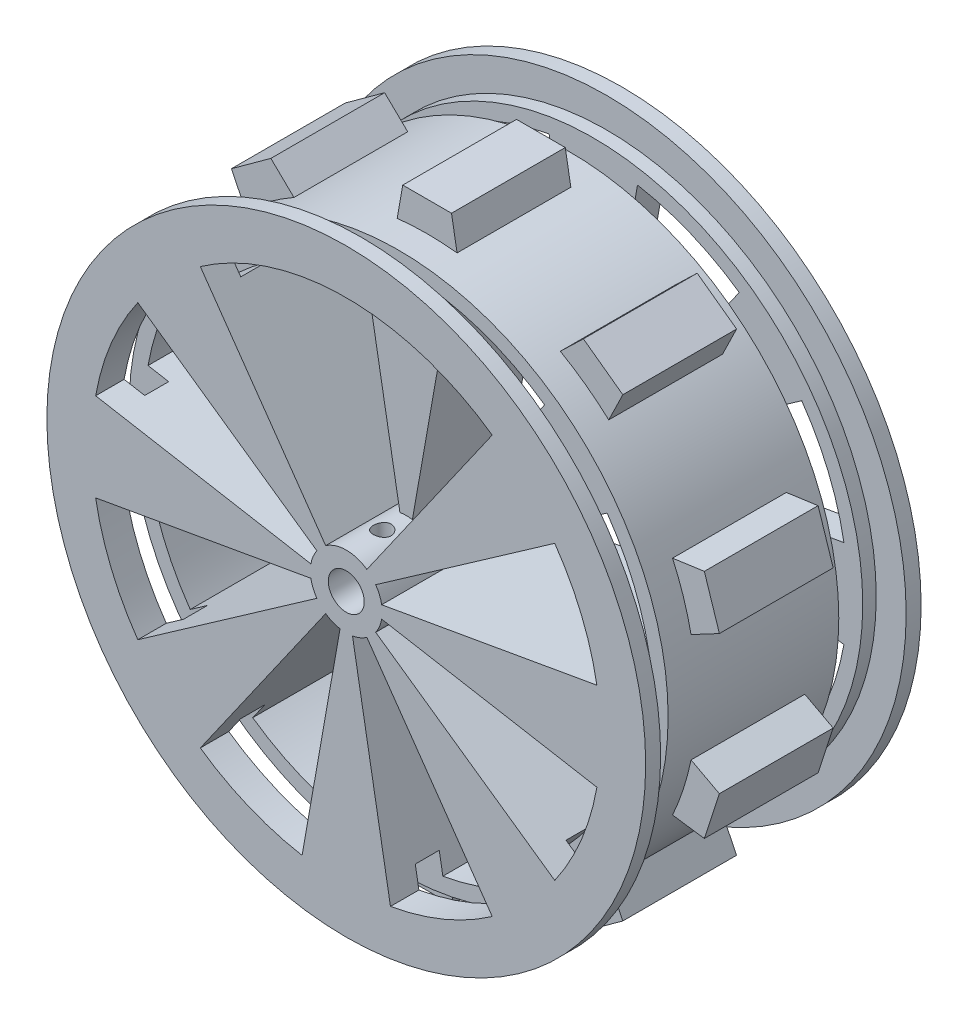
from build123d import *
from build123d.topology import SkipClean

# Parameters (mm, degrees)
CROQUIS2_R                   = 45
CROQUIS2_R_2                 = 7.5
SALIENTE_EXTRUIR1_DEPTH      = 40
SALIENTE_EXTRUIR2_DEPTH      = 9.5
SALIENTE_EXTRUIR2_DEPTH_BACK = 9.5
CROQUIS4_R                   = 42.5
CORTAR_EXTRUIR1_DEPTH        = 58
SALIENTE_EXTRUIR3_START      = 3
CROQUIS5_R                   = 50
CROQUIS5_R_2                 = 42.5
SALIENTE_EXTRUIR3_DEPTH      = 3
CROQUIS6_R                   = 50
CROQUIS6_R_2                 = 45
CORTAR_EXTRUIR2_DEPTH        = 0.5
CROQUIS7_R                   = 50
CROQUIS7_R_2                 = 42.5
SALIENTE_EXTRUIR4_DEPTH      = 3
CROQUIS8_R                   = 50
CROQUIS8_R_2                 = 45
CORTAR_EXTRUIR3_DEPTH        = 0.5
CROQUIS9_R                   = 3
SALIENTE_EXTRUIR5_DEPTH      = 46
CORTAR_EXTRUIR5_DEPTH        = 10
CROQUIS13_R                  = 1.5
CORTAR_EXTRUIR7_DEPTH        = 7
CROQUIS15_W                  = 6
CROQUIS15_H                  = 4
CROQUIS16_R                  = 30
CORTAR_EXTRUIR8_DEPTH        = 20


with BuildPart() as part:
    # Croquis2 → Saliente-Extruir1 (new body)
    with BuildSketch(Plane.XY):
        Circle(CROQUIS2_R)
        Circle(CROQUIS2_R_2, mode=Mode.SUBTRACT)
    extrude(amount=SALIENTE_EXTRUIR1_DEPTH)

    # Croquis3 → Saliente-Extruir2 (add, two sides: drawn at the far end of the back side and taken through both)
    with BuildSketch(Plane.XY.offset(20).offset(-SALIENTE_EXTRUIR2_DEPTH_BACK)):
        with BuildLine():
            ThreePointArc((-4.995681638, 44.721842146), (0.004345244, 44.99999979), (5.004318315, 44.720876537))
            Line((5.004318315, 44.720876537), (4.073466414, 50))
            Line((4.073466414, 50), (0, 50))
            Line((0, 50), (-4.065, 50))
            Line((-4.065, 50), (-4.995681638, 44.721842146))
        make_face()
        with BuildLine():
            Line((29.389262615, 40.450849719), (26.100608532, 42.840196769))
            Line((26.100608532, 42.840196769), (22.245247925, 39.117118308))
            ThreePointArc((22.245247925, 39.117118308), (26.453851606, 36.403210507), (30.33485026, 33.238484618))
            Line((30.33485026, 33.238484618), (32.68476617, 38.056526235))
            Line((32.68476617, 38.056526235), (29.389262615, 40.450849719))
        make_face()
        with BuildLine():
            Line((46.296671733, 19.316894457), (40.989248869, 18.570984818))
            ThreePointArc((40.989248869, 18.570984818), (42.798885788, 13.901632109), (44.078500449, 9.06012131))
            Line((44.078500449, 9.06012131), (48.811596163, 11.576752942))
            Line((48.811596163, 11.576752942), (47.552825815, 15.450849719))
            Line((47.552825815, 15.450849719), (46.296671733, 19.316894457))
        make_face()
        with BuildLine():
            Line((48.808979897, -11.58480498), (44.076749919, -9.068633668))
            ThreePointArc((44.076749919, -9.068633668), (42.796200279, -13.909897255), (40.98566164, -18.578900397))
            Line((40.98566164, -18.578900397), (46.294055467, -19.324946496))
            Line((46.294055467, -19.324946496), (47.552825815, -15.450849719))
            Line((47.552825815, -15.450849719), (48.808979897, -11.58480498))
        make_face()
        with BuildLine():
            Line((32.677916697, -38.061502668), (30.328430613, -33.244342324))
            ThreePointArc((30.328430613, -33.244342324), (26.446820853, -36.408318648), (22.237693135, -39.121413625))
            Line((22.237693135, -39.121413625), (26.093759059, -42.845173203))
            Line((26.093759059, -42.845173203), (29.389262615, -40.450849719))
            Line((29.389262615, -40.450849719), (32.677916697, -38.061502668))
        make_face()
        with BuildLine():
            Line((4.065, -50), (4.995681638, -44.721842146))
            ThreePointArc((4.995681638, -44.721842146), (-0.004345244, -44.99999979), (-5.004318315, -44.720876537))
            Line((-5.004318315, -44.720876537), (-4.073466414, -50))
            Line((-4.073466414, -50), (0, -50))
            Line((0, -50), (4.065, -50))
        make_face()
        with BuildLine():
            ThreePointArc((-22.245247925, -39.117118308), (-26.453851606, -36.403210507), (-30.33485026, -33.238484618))
            Line((-30.33485026, -33.238484618), (-32.68476617, -38.056526235))
            Line((-32.68476617, -38.056526235), (-29.389262615, -40.450849719))
            Line((-29.389262615, -40.450849719), (-26.100608532, -42.840196769))
            Line((-26.100608532, -42.840196769), (-22.245247925, -39.117118308))
        make_face()
        with BuildLine():
            ThreePointArc((-40.989248869, -18.570984818), (-42.798885788, -13.901632109), (-44.078500449, -9.06012131))
            Line((-44.078500449, -9.06012131), (-48.811596163, -11.576752942))
            Line((-48.811596163, -11.576752942), (-47.552825815, -15.450849719))
            Line((-47.552825815, -15.450849719), (-46.296671733, -19.316894457))
            Line((-46.296671733, -19.316894457), (-40.989248869, -18.570984818))
        make_face()
        with BuildLine():
            ThreePointArc((-30.328430613, 33.244342324), (-26.446820853, 36.408318648), (-22.237693135, 39.121413625))
            Line((-22.237693135, 39.121413625), (-26.093759059, 42.845173203))
            Line((-26.093759059, 42.845173203), (-29.389262615, 40.450849719))
            Line((-29.389262615, 40.450849719), (-32.677916697, 38.061502668))
            Line((-32.677916697, 38.061502668), (-30.328430613, 33.244342324))
        make_face()
        with BuildLine():
            ThreePointArc((-44.076749919, 9.068633668), (-42.796200279, 13.909897255), (-40.98566164, 18.578900397))
            Line((-40.98566164, 18.578900397), (-46.294055467, 19.324946496))
            Line((-46.294055467, 19.324946496), (-47.552825815, 15.450849719))
            Line((-47.552825815, 15.450849719), (-48.808979897, 11.58480498))
            Line((-48.808979897, 11.58480498), (-44.076749919, 9.068633668))
        make_face()
    extrude(amount=SALIENTE_EXTRUIR2_DEPTH + SALIENTE_EXTRUIR2_DEPTH_BACK)

    # Croquis4 → Cortar-Extruir1 (cut)
    with BuildSketch(Plane.XY.offset(40)):
        Circle(CROQUIS4_R)
    extrude(amount=-CORTAR_EXTRUIR1_DEPTH, mode=Mode.SUBTRACT)

    # Croquis5 → Saliente-Extruir3 (add)
    with BuildSketch(Plane.XY.offset(40).offset(SALIENTE_EXTRUIR3_START)):
        Circle(CROQUIS5_R)
        Circle(CROQUIS5_R_2, mode=Mode.SUBTRACT)
    extrude(amount=-SALIENTE_EXTRUIR3_DEPTH)

    # Croquis6 → Cortar-Extruir2 (cut)
    with SkipClean():  # the faces are left unmerged after this step: merging them gives an invalid solid
        with BuildSketch(Plane(origin=(0, 0, 40), x_dir=(-1, 0, 0), z_dir=(0, 0, -1))):
            Circle(CROQUIS6_R)
            Circle(CROQUIS6_R_2, mode=Mode.SUBTRACT)
        extrude(amount=-CORTAR_EXTRUIR2_DEPTH, mode=Mode.SUBTRACT)

    # Croquis7 → Saliente-Extruir4 (add)
    with SkipClean():  # the faces are left unmerged after this step: merging them gives an invalid solid
        with BuildSketch(Plane(origin=(0, 0, 0), x_dir=(-1, 0, 0), z_dir=(0, 0, -1))):
            Circle(CROQUIS7_R)
            with Locations(Location((0, 0, 0), (0, 0, 180))):
                Circle(CROQUIS7_R_2, mode=Mode.SUBTRACT)
        extrude(amount=SALIENTE_EXTRUIR4_DEPTH)

    # Croquis8 → Cortar-Extruir3 (cut)
    with SkipClean():  # the faces are left unmerged after this step: merging them gives an invalid solid
        with BuildSketch(Plane.XY):
            Circle(CROQUIS8_R)
            with Locations(Location((0, 0, 0), (0, 0, 180))):
                Circle(CROQUIS8_R_2, mode=Mode.SUBTRACT)
        extrude(amount=-CORTAR_EXTRUIR3_DEPTH, mode=Mode.SUBTRACT)

    # Croquis9 → Saliente-Extruir5 (add, through all)
    with SkipClean():  # the faces are left unmerged after this step: merging them gives an invalid solid
        with BuildSketch(Plane.XY.offset(43)):
            with BuildLine():
                Line((5.908846518, -1.041889066), (41.854329503, -7.380047551))
                ThreePointArc((41.854329503, -7.380047551), (42.5, 0), (41.854329503, 7.380047551))
                Line((41.854329503, 7.380047551), (5.908846518, 1.041889066))
                ThreePointArc((5.908846518, 1.041889066), (5.543277195, 2.296100594), (4.914912266, 3.441458618))
                Line((4.914912266, 3.441458618), (34.813961882, 24.376998545))
                ThreePointArc((34.813961882, 24.376998545), (30.0520382, 30.0520382), (24.376998545, 34.813961882))
                Line((24.376998545, 34.813961882), (3.441458618, 4.914912266))
                ThreePointArc((3.441458618, 4.914912266), (2.296100594, 5.543277195), (1.041889066, 5.908846518))
                Line((1.041889066, 5.908846518), (7.380047551, 41.854329503))
                ThreePointArc((7.380047551, 41.854329503), (0, 42.5), (-7.380047551, 41.854329503))
                Line((-7.380047551, 41.854329503), (-1.041889066, 5.908846518))
                ThreePointArc((-1.041889066, 5.908846518), (-2.296100594, 5.543277195), (-3.441458618, 4.914912266))
                Line((-3.441458618, 4.914912266), (-24.376998545, 34.813961882))
                ThreePointArc((-24.376998545, 34.813961882), (-30.0520382, 30.0520382), (-34.813961882, 24.376998545))
                Line((-34.813961882, 24.376998545), (-4.914912266, 3.441458618))
                ThreePointArc((-4.914912266, 3.441458618), (-5.543277195, 2.296100594), (-5.908846518, 1.041889066))
                Line((-5.908846518, 1.041889066), (-41.854329503, 7.380047551))
                ThreePointArc((-41.854329503, 7.380047551), (-42.5, 0), (-41.854329503, -7.380047551))
                Line((-41.854329503, -7.380047551), (-5.908846518, -1.041889066))
                ThreePointArc((-5.908846518, -1.041889066), (-5.543277195, -2.296100594), (-4.914912266, -3.441458618))
                Line((-4.914912266, -3.441458618), (-34.813961882, -24.376998545))
                ThreePointArc((-34.813961882, -24.376998545), (-30.0520382, -30.0520382), (-24.376998545, -34.813961882))
                Line((-24.376998545, -34.813961882), (-3.441458618, -4.914912266))
                ThreePointArc((-3.441458618, -4.914912266), (-2.296100594, -5.543277195), (-1.041889066, -5.908846518))
                Line((-1.041889066, -5.908846518), (-7.380047551, -41.854329503))
                ThreePointArc((-7.380047551, -41.854329503), (0, -42.5), (7.380047551, -41.854329503))
                Line((7.380047551, -41.854329503), (1.041889066, -5.908846518))
                ThreePointArc((1.041889066, -5.908846518), (2.296100594, -5.543277195), (3.441458618, -4.914912266))
                Line((3.441458618, -4.914912266), (24.376998545, -34.813961882))
                ThreePointArc((24.376998545, -34.813961882), (30.0520382, -30.0520382), (34.813961882, -24.376998545))
                Line((34.813961882, -24.376998545), (4.914912266, -3.441458618))
                ThreePointArc((4.914912266, -3.441458618), (5.543277195, -2.296100594), (5.908846518, -1.041889066))
            make_face()
            Circle(CROQUIS9_R, mode=Mode.SUBTRACT)
        extrude(amount=-SALIENTE_EXTRUIR5_DEPTH)

    # Croquis11 → Cortar-Extruir5 (cut)
    with SkipClean():  # the faces are left unmerged after this step: merging them gives an invalid solid
        with BuildSketch(Plane.XY.offset(43)):
            with BuildLine():
                Line((7.380047551, 41.854329503), (1.041889066, 5.908846518))
                ThreePointArc((1.041889066, 5.908846518), (0, 6), (-1.041889066, 5.908846518))
                Line((-1.041889066, 5.908846518), (-7.380047551, 41.854329503))
                ThreePointArc((-7.380047551, 41.854329503), (0, 42.5), (7.380047551, 41.854329503))
            make_face()
        extrude(amount=-CORTAR_EXTRUIR5_DEPTH, mode=Mode.SUBTRACT)

    # Croquis13 → Cortar-Extruir7 (cut)
    with SkipClean():  # the faces are left unmerged after this step: merging them gives an invalid solid
        with BuildSketch(Plane(origin=(0, 7, 0), x_dir=(1, 0, 0), z_dir=(0, 1, 0))):
            with Locations(Location((0, -37, 0), (0, 0, 270))):
                Circle(CROQUIS13_R)
        extrude(amount=-CORTAR_EXTRUIR7_DEPTH, mode=Mode.SUBTRACT)

    # Croquis15 → Cortar-Revolución1 (revolve, cut)
    with BuildSketch(Plane(origin=(0, 0, 0), x_dir=(1, 0, 0), z_dir=(0, 1, 0))):
        with Locations((-42, -3.75)):
            Rectangle(CROQUIS15_W, CROQUIS15_H)
        with Locations((-42, -36.25)):
            Rectangle(CROQUIS15_W, CROQUIS15_H)
    revolve(axis=Axis((0, 0, 0), (0, 0, -1)), mode=Mode.SUBTRACT)

    # Croquis16 → Cortar-Extruir8 (cut)
    with BuildSketch(Plane(origin=(0, 0, -3), x_dir=(-1, 0, 0), z_dir=(0, 0, -1))):
        Circle(CROQUIS16_R)
    extrude(amount=-CORTAR_EXTRUIR8_DEPTH, mode=Mode.SUBTRACT)


solid = part.part
